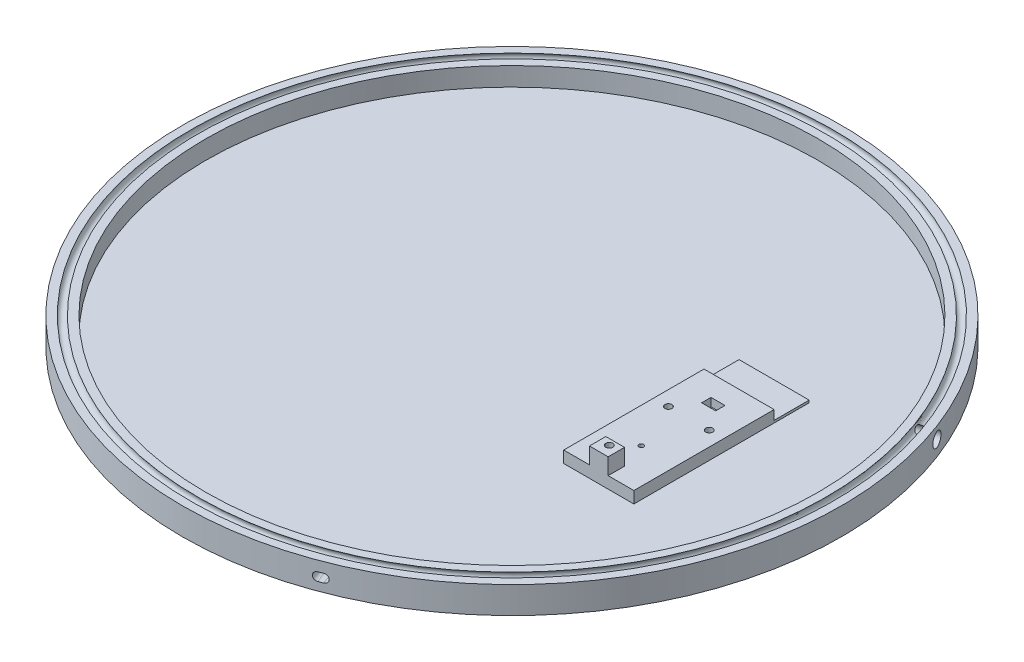
from build123d import *

# Parameters (mm, degrees)
SKETCH1_R                 = 141
BOSS_EXTRUDE1_DEPTH       = 3.5
SKETCH2_R                 = 141
SKETCH2_R_2               = 131
BOSS_EXTRUDE2_DEPTH       = 8
SKETCH5_R                 = 2
CUT_EXTRUDE3_DEPTH        = 5
CUT_EXTRUDE3_DEPTH_BACK   = 15
SKETCH7_W                 = 30
SKETCH7_H                 = 75
SKETCH7_R                 = 1
BOSS_EXTRUDE3_DEPTH       = 5
SKETCH8_W                 = 8
SKETCH8_H                 = 7
BOSS_EXTRUDE4_DEPTH       = 7
SKETCH9_W                 = 6
SKETCH9_H                 = 4
CUT_EXTRUDE6_DEPTH        = 3.5
F_3_0MM_DOWEL_HOLE2_D     = 3
F_3_0MM_DOWEL_HOLE2_DEPTH = 10
F_3_0MM_DOWEL_HOLE2_TIP   = 0.901290929
F_3_0MM_DOWEL_HOLE3_D     = 3
F_3_0MM_DOWEL_HOLE3_DEPTH = 5
F_3_0MM_DOWEL_HOLE3_TIP   = 0.901290929
SKETCH10_W                = 30
SKETCH10_H                = 15
CUT_EXTRUDE7_DEPTH        = 4
SKETCH15_R                = 3
CUT_EXTRUDE9_DEPTH        = 15


with BuildPart() as part:
    # Sketch1 → Boss-Extrude1 (new body)
    with BuildSketch(Plane(origin=(0, 0, 0), x_dir=(1, 0, 0), z_dir=(0, 1, 0))):
        Circle(SKETCH1_R)
    extrude(amount=BOSS_EXTRUDE1_DEPTH)

    # Sketch2 → Boss-Extrude2 (add)
    with BuildSketch(Plane(origin=(0, 3.5, 0), x_dir=(1, 0, 0), z_dir=(0, 1, 0))):
        Circle(SKETCH2_R)
        Circle(SKETCH2_R_2, mode=Mode.SUBTRACT)
    extrude(amount=BOSS_EXTRUDE2_DEPTH)

    # Cut-Sweep1: sweep along a path in Sketch3
    with BuildLine(Plane(origin=(0, 11.5, 0), x_dir=(1, 0, 0), z_dir=(0, 1, 0))) as cut_sweep1_path:
        CenterArc((0, 0), 136, 0, 360)
    # Sketch5 → Cut-Sweep1 (sweep, cut)
    with BuildSketch(Plane(origin=(0, 0, 0), x_dir=(0.35486692076616666, 0, 0.934916824399871), z_dir=(-0.9349168243998711, 0, 0.35486692076616666))):
        with Locations((136, 10.2)):
            Circle(SKETCH5_R)
    sweep(path=cut_sweep1_path.line, mode=Mode.SUBTRACT)

    # Sketch6 → Cut-Extrude3 (cut, two sides: drawn at the far end of the back side and taken through both)
    with BuildSketch(Plane(origin=(46.48756662, 0, 122.474103996), x_dir=(-0.9349168243998711, 0, 0.3548669207661666), z_dir=(-0.3548669207661666, 0, -0.9349168243998711)).offset(-CUT_EXTRUDE3_DEPTH_BACK)):
        with BuildLine():
            Line((1, 3.599112528), (-1, 3.599112528))
            ThreePointArc((-1, 3.599112528), (-2.8, 5.399112528), (-1, 7.199112528))
            Line((-1, 7.199112528), (1, 7.199112528))
            ThreePointArc((1, 7.199112528), (2.8, 5.399112528), (1, 3.599112528))
        make_face()
    extrude(amount=CUT_EXTRUDE3_DEPTH + CUT_EXTRUDE3_DEPTH_BACK, mode=Mode.SUBTRACT)

    # Sketch7 → Boss-Extrude3 (add)
    with BuildSketch(Plane(origin=(0, 3.5, 0), x_dir=(1, 0, 0), z_dir=(0, 1, 0))):
        with Locations((72.91731325, 1.748207258)):
            Rectangle(SKETCH7_W, SKETCH7_H)
        with Locations((72.91731325, -17.551792742)):
            Circle(SKETCH7_R, mode=Mode.SUBTRACT)
    extrude(amount=BOSS_EXTRUDE3_DEPTH)

    # Sketch8 → Boss-Extrude4 (add)
    with BuildSketch(Plane(origin=(0, 8.5, 0), x_dir=(1, 0, 0), z_dir=(0, 1, 0))):
        with Locations((72.91731325, -32.251792742)):
            Rectangle(SKETCH8_W, SKETCH8_H)
    extrude(amount=BOSS_EXTRUDE4_DEPTH)

    # Sketch9 → Cut-Extrude6 (cut)
    with BuildSketch(Plane(origin=(0, 8.5, 0), x_dir=(1, 0, 0), z_dir=(0, 1, 0))):
        with Locations((72.91731325, 13.248207258)):
            Rectangle(SKETCH9_W, SKETCH9_H)
    extrude(amount=-CUT_EXTRUDE6_DEPTH, mode=Mode.SUBTRACT)

    # Ø3.0mm Dowel Hole2
    with Locations(Plane(origin=(0, 15.5, 0), x_dir=(1, 0, 0), z_dir=(0, 1, 0))):
        with Locations((72.91731325, -31.251792742)):
            Hole(F_3_0MM_DOWEL_HOLE2_D / 2, depth=F_3_0MM_DOWEL_HOLE2_DEPTH)
            with Locations((0, 0, -(F_3_0MM_DOWEL_HOLE2_DEPTH + F_3_0MM_DOWEL_HOLE2_TIP / 2))):  # 118° drill point
                Cone(0, F_3_0MM_DOWEL_HOLE2_D / 2, F_3_0MM_DOWEL_HOLE2_TIP, mode=Mode.SUBTRACT)

    # Ø3.0mm Dowel Hole3
    with Locations(Plane(origin=(64.16731325, 8.5, -2.748207258), x_dir=(0, 0, 1), z_dir=(0, 1, 0))):
        with Locations((0, 0), (0, 17.5)):
            Hole(F_3_0MM_DOWEL_HOLE3_D / 2, depth=F_3_0MM_DOWEL_HOLE3_DEPTH)
            with Locations((0, 0, -(F_3_0MM_DOWEL_HOLE3_DEPTH + F_3_0MM_DOWEL_HOLE3_TIP / 2))):  # 118° drill point
                Cone(0, F_3_0MM_DOWEL_HOLE3_D / 2, F_3_0MM_DOWEL_HOLE3_TIP, mode=Mode.SUBTRACT)

    # Sketch10 → Cut-Extrude7 (cut)
    with BuildSketch(Plane(origin=(0, 8.5, 0), x_dir=(1, 0, 0), z_dir=(0, 1, 0))):
        with Locations((72.91731325, 31.748207258)):
            Rectangle(SKETCH10_W, SKETCH10_H)
    extrude(amount=-CUT_EXTRUDE7_DEPTH, mode=Mode.SUBTRACT)

    # Sketch15 → Cut-Extrude9 (cut)
    with BuildSketch(Plane(origin=(131.82327224, 0, -50.036235828), x_dir=(-0.3548669207661667, 0, -0.934916824399871), z_dir=(0.934916824399871, 0, -0.3548669207661667))):
        with Locations((0, 6.5)):
            Circle(SKETCH15_R)
    extrude(amount=-CUT_EXTRUDE9_DEPTH, mode=Mode.SUBTRACT)


solid = part.part
